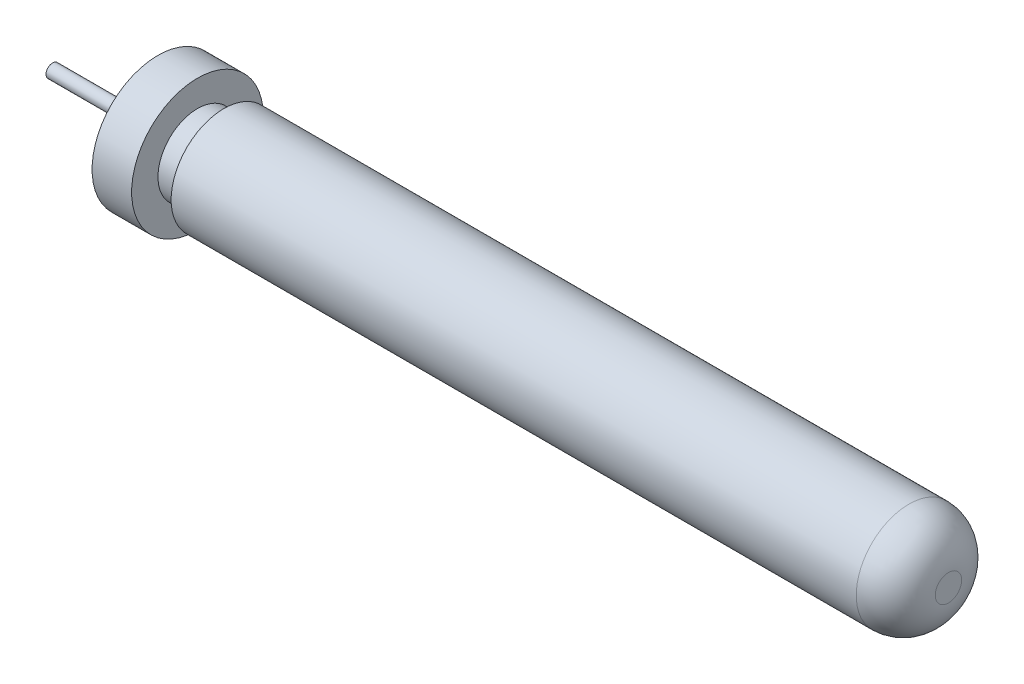
from build123d import *

# Parameters (mm, degrees)
FILLET_1_R = 3


with BuildPart() as part:
    # Эскиз1 → Повернуть1 (revolve)
    with BuildSketch(Plane.XY, mode=Mode.PRIVATE) as revolve_1_sk:
        Polygon((0, 0), (0, 0.5), (6, 0.5), (6, 2), (8, 2), (8, 5), (11, 5), (11, 3), (13, 3), (13, 4), (68, 4), (68, 0), align=None)
    revolve(revolve_1_sk.sketch.rotate(Axis((68, 0, 0), (-1, 0, 0)), 90), axis=Axis((68, 0, 0), (-1, 0, 0)))

    # Скругление1
    fillet_1_edges = [part.edges().sort_by_distance(p)[0] for p in [
        (68, 0, 4),
    ]]
    fillet(fillet_1_edges, radius=FILLET_1_R)


solid = part.part
